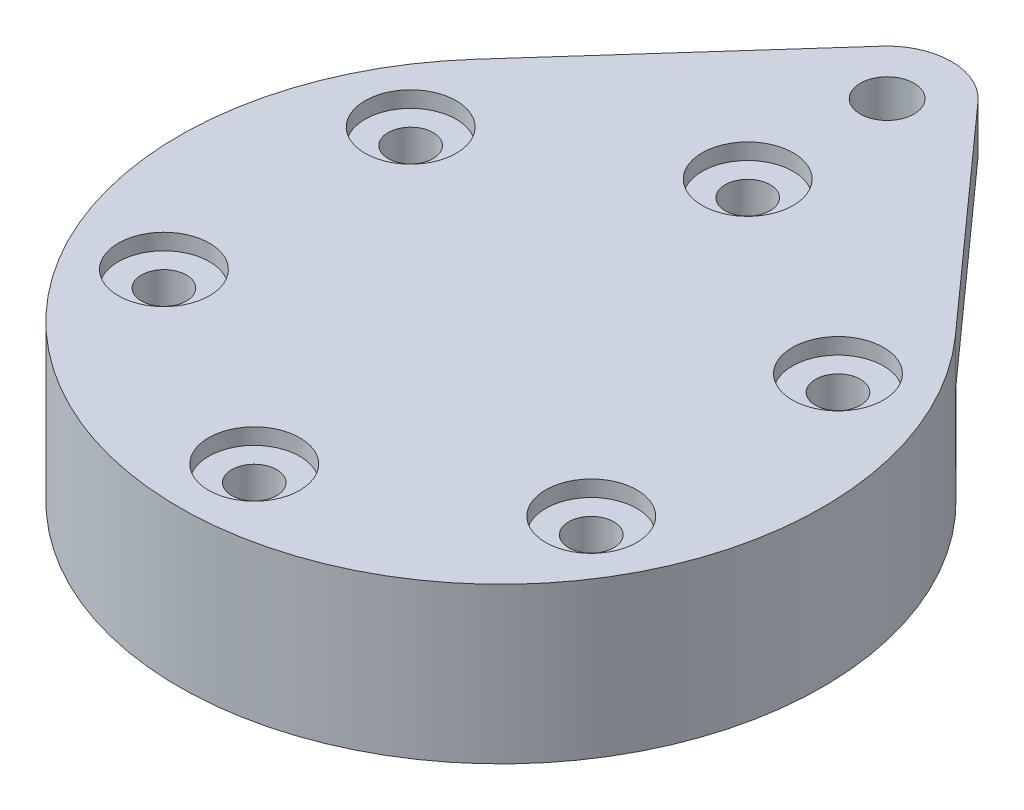
from build123d import *

# Parameters (mm, degrees)
SKETCH1_R           = 6
SKETCH1_R_2         = 2.5
BOSS_EXTRUDE1_DEPTH = 4.5
SKETCH2_R           = 4.25
CUT_EXTRUDE1_DEPTH  = 1.5
BOSS_EXTRUDE2_START = 10
SKETCH3_R           = 30
BOSS_EXTRUDE2_DEPTH = 10
SKETCH4_R           = 2.1
CUT_EXTRUDE2_DEPTH  = 43


with BuildPart() as part:
    # Sketch1 → Boss-Extrude1 (new body)
    # profile 1 of 4: a face of its own
    with BuildSketch(Plane(origin=(0, 0, 0), x_dir=(1, 0, 0), z_dir=(0, 1, 0))):
        with BuildLine():
            ThreePointArc((0, 30), (-12.247448714, 27.386127875), (-22.360679775, 20))
            ThreePointArc((-22.360679775, 20), (-10.704662693, -28.025170769), (30, 0))
            ThreePointArc((30, 0), (28.025170769, 10.704662693), (22.360679775, 20))
            ThreePointArc((22.360679775, 20), (12.247448714, 27.386127875), (0, 30))
        make_face()
    # profile 2 of 4: a face of its own
    with BuildSketch(Plane(origin=(0, 0, 0), x_dir=(1, 0, 0), z_dir=(0, 1, 0))):
        with BuildLine():
            Line((22.360679775, 20), (4.472135955, 40))
            ThreePointArc((4.472135955, 40), (5.605034154, 38.140932539), (6, 36))
            ThreePointArc((6, 36), (4.242640687, 31.757359313), (0, 30))
            ThreePointArc((0, 30), (12.247448714, 27.386127875), (22.360679775, 20))
        make_face()
    # profile 3 of 4: a face of its own
    with BuildSketch(Plane(origin=(0, 0, 0), x_dir=(1, 0, 0), z_dir=(0, 1, 0))):
        with BuildLine():
            ThreePointArc((0, 30), (-5.477225575, 33.550510257), (-4.472135955, 40))
            Line((-4.472135955, 40), (-22.360679775, 20))
            ThreePointArc((-22.360679775, 20), (-12.247448714, 27.386127875), (0, 30))
        make_face()
    # profile 4 of 4: a face of its own
    with BuildSketch(Plane(origin=(0, 0, 0), x_dir=(1, 0, 0), z_dir=(0, 1, 0))):
        with Locations((0, 36)):
            Circle(SKETCH1_R)
        with Locations(Location((0, 36, 0), (0, 0, 270))):
            Circle(SKETCH1_R_2, mode=Mode.SUBTRACT)
    extrude(amount=BOSS_EXTRUDE1_DEPTH)

    # Sketch2 → Cut-Extrude1 (cut)
    with BuildSketch(Plane(origin=(0, 4.5, 0), x_dir=(1, 0, 0), z_dir=(0, 1, 0))):
        with Locations(Location((0, 23, 0), (0, 0, 270))):
            Circle(SKETCH2_R)
        with Locations(Location((19.918584287, 11.5, 0), (0, 0, 270))):
            Circle(SKETCH2_R)
        with Locations(Location((19.918584287, -11.5, 0), (0, 0, 270))):
            Circle(SKETCH2_R)
        with Locations(Location((0, -23, 0), (0, 0, 270))):
            Circle(SKETCH2_R)
        with Locations(Location((-19.918584287, -11.5, 0), (0, 0, 270))):
            Circle(SKETCH2_R)
        with Locations(Location((-19.918584287, 11.5, 0), (0, 0, 270))):
            Circle(SKETCH2_R)
    extrude(amount=-CUT_EXTRUDE1_DEPTH, mode=Mode.SUBTRACT)

    # Sketch3 → Boss-Extrude2 (add)
    with BuildSketch(Plane.XZ.offset(BOSS_EXTRUDE2_START)):
        with Locations(Location((0, 0, 0), (0, 0, 270))):
            Circle(SKETCH3_R)
    extrude(amount=-BOSS_EXTRUDE2_DEPTH)

    # Sketch4 → Cut-Extrude2 (cut)
    with BuildSketch(Plane(origin=(0, 4.5, 0), x_dir=(1, 0, 0), z_dir=(0, 1, 0))):
        with Locations(Location((0, 23, 0), (0, 0, 270))):
            Circle(SKETCH4_R)
        with Locations(Location((19.918584287, 11.5, 0), (0, 0, 270))):
            Circle(SKETCH4_R)
        with Locations(Location((19.918584287, -11.5, 0), (0, 0, 270))):
            Circle(SKETCH4_R)
        with Locations(Location((0, -23, 0), (0, 0, 270))):
            Circle(SKETCH4_R)
        with Locations(Location((-19.918584287, -11.5, 0), (0, 0, 270))):
            Circle(SKETCH4_R)
        with Locations(Location((-19.918584287, 11.5, 0), (0, 0, 270))):
            Circle(SKETCH4_R)
    extrude(amount=-CUT_EXTRUDE2_DEPTH, mode=Mode.SUBTRACT)


solid = part.part
